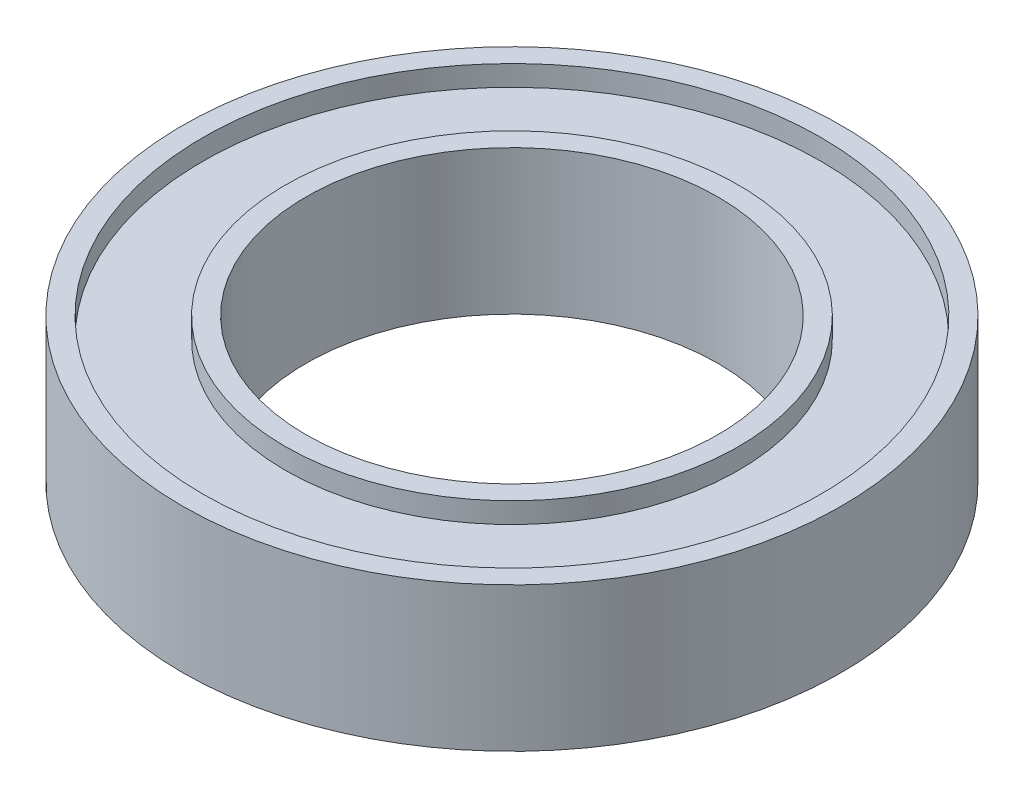
from build123d import *

# Parameters (mm, degrees)
SKETCH1_R           = 16
SKETCH1_R_2         = 10
BOSS_EXTRUDE1_DEPTH = 7
SKETCH2_R           = 15
SKETCH2_R_2         = 11
CUT_EXTRUDE1_DEPTH  = 1
CUT_EXTRUDE2_START  = -1
SKETCH3_R           = 15
SKETCH3_R_2         = 11
CUT_EXTRUDE2_DEPTH  = 1


with BuildPart() as part:
    # Sketch1 → Boss-Extrude1 (new body)
    with BuildSketch(Plane(origin=(0, 0, 0), x_dir=(1, 0, 0), z_dir=(0, 1, 0))):
        with Locations(Location((0, 0, 0), (0, 0, 270))):
            Circle(SKETCH1_R)
        with Locations(Location((0, 0, 0), (0, 0, 270))):
            Circle(SKETCH1_R_2, mode=Mode.SUBTRACT)
    extrude(amount=BOSS_EXTRUDE1_DEPTH)

    # Sketch2 → Cut-Extrude1 (cut)
    with BuildSketch(Plane(origin=(0, 7, 0), x_dir=(1, 0, 0), z_dir=(0, 1, 0))):
        with Locations(Location((0, 0, 0), (0, 0, 270))):
            Circle(SKETCH2_R)
        with Locations(Location((0, 0, 0), (0, 0, 270))):
            Circle(SKETCH2_R_2, mode=Mode.SUBTRACT)
    extrude(amount=-CUT_EXTRUDE1_DEPTH, mode=Mode.SUBTRACT)

    # Sketch3 → Cut-Extrude2 (cut)
    with BuildSketch(Plane.XZ.offset(CUT_EXTRUDE2_START)):
        with Locations(Location((0, 0, 0), (0, 0, 90))):
            Circle(SKETCH3_R)
        with Locations(Location((0, 0, 0), (0, 0, 90))):
            Circle(SKETCH3_R_2, mode=Mode.SUBTRACT)
    extrude(amount=CUT_EXTRUDE2_DEPTH, mode=Mode.SUBTRACT)


solid = part.part
